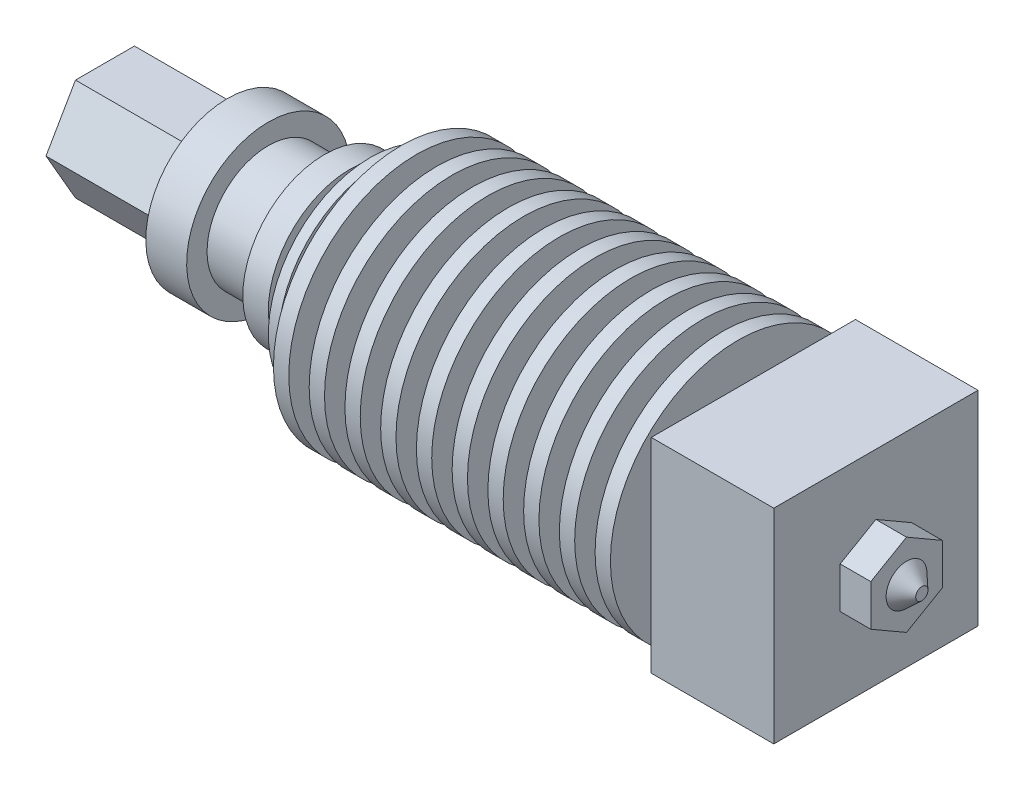
from build123d import *

# Parameters (mm, degrees)
SKETCH_2_R      = 3
EXTRUDE_1_DEPTH = 1.5
SKETCH_3_W      = 20
SKETCH_3_H      = 20
EXTRUDE_2_DEPTH = 12
EXTRUDE_3_DEPTH = 3
EXTRUDE_4_DEPTH = 12


with BuildPart() as part:
    # 草圖1 → 旋轉1 (revolve)
    with BuildSketch(Plane.XY):
        Polygon((0, 0), (-50, 0), (-50, 8), (-46, 8), (-46, 6), (-40.5, 6), (-40.5, 8), (-38, 8), (-38, 4.5), (-36, 4.5), (-36, 10), (-35, 10), (-35, 7.5), (-33, 7.5), (-33, 12.5), (-31.5, 12.5), (-31.5, 7.5), (-29.5, 7.5), (-29.5, 12.5), (-28, 12.5), (-28, 7.5), (-26, 7.5), (-26, 12.5), (-24.5, 12.5), (-24.5, 7.5), (-22.5, 7.5), (-22.5, 12.5), (-21, 12.5), (-21, 7.5), (-19, 7.5), (-19, 12.5), (-17.5, 12.5), (-17.5, 7.5), (-15.5, 7.5), (-15.5, 12.5), (-14, 12.5), (-14, 7.5), (-12, 7.5), (-12, 12.5), (-10.5, 12.5), (-10.5, 7.5), (-8.5, 7.5), (-8.5, 12.5), (-7, 12.5), (-7, 7.5), (-5, 7.5), (-5, 12.5), (-3.5, 12.5), (-3.5, 7.5), (-1.5, 7.5), (-1.5, 12.5), (0, 12.5), align=None)
    revolve(axis=Axis((0, 0, 0), (-1, 0, 0)))

    # 草圖2 → 填料-伸長1 (add)
    with BuildSketch(Plane(origin=(0, 0, 0), x_dir=(0, 0, -1), z_dir=(1, 0, 0))):
        with Locations(Location((0, 0, 0), (0, 0, 90))):
            Circle(SKETCH_2_R)
    extrude(amount=EXTRUDE_1_DEPTH)

    # 草圖3 → 填料-伸長2 (add)
    with BuildSketch(Plane(origin=(1.5, 0, 0), x_dir=(0, 0, -1), z_dir=(1, 0, 0))):
        Rectangle(SKETCH_3_W, SKETCH_3_H)
    extrude(amount=EXTRUDE_2_DEPTH)

    # 草圖4 → 填料-伸長3 (add)
    with BuildSketch(Plane(origin=(13.5, 0, 0), x_dir=(0, 0, -1), z_dir=(1, 0, 0))):
        Polygon((0, 4.041451884), (-3.5, 2.020725942), (-3.5, -2.020725942), (0, -4.041451884), (3.5, -2.020725942), (3.5, 2.020725942), align=None)
    extrude(amount=EXTRUDE_3_DEPTH)

    # 草圖6 → 旋轉2 (revolve)
    with BuildSketch(Plane.XY, mode=Mode.PRIVATE) as revolve_2_sk:
        Polygon((16.5, 0), (18, 0), (18, 0.6), (16.5, 2), align=None)
    revolve(revolve_2_sk.sketch.rotate(Axis((16.5, 0, 0), (1, 0, 0)), 180), axis=Axis((16.5, 0, 0), (1, 0, 0)))

    # 草圖7 → 填料-伸長4 (add)
    with BuildSketch(Plane.ZY.offset(50)):
        Polygon((-5.773502692, 0), (-2.886751346, -5), (2.886751346, -5), (5.773502692, 0), (2.886751346, 5), (-2.886751346, 5), align=None)
    extrude(amount=EXTRUDE_4_DEPTH)


solid = part.part
